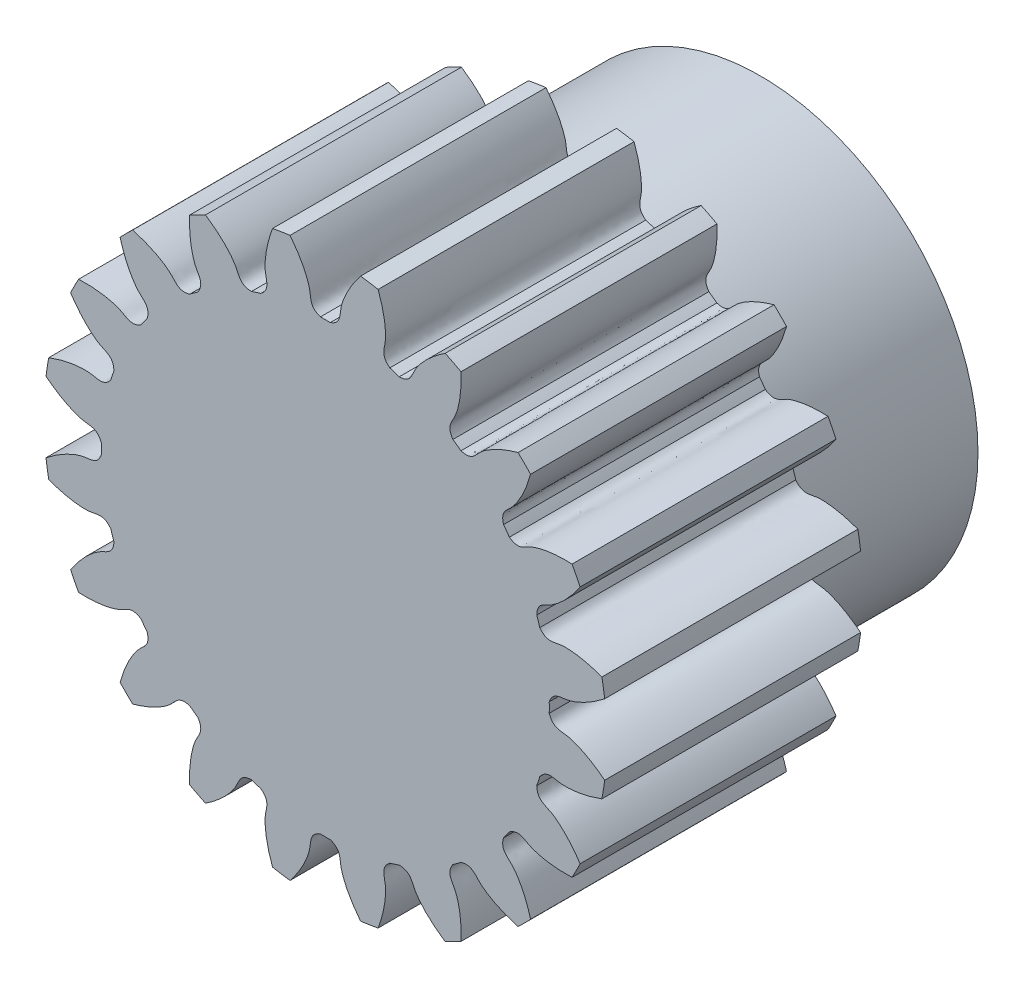
from build123d import *

# Parameters (mm, degrees)
SKETCH_1_R               = 22
EXTRUDE_1_DEPTH          = 20
CUT_EXTRUDE_1_DEPTH      = 37.986484018
PATTERN_CIRCULAR_1_COUNT = 20
SKETCH_4_R               = 17
EXTRUDE_2_DEPTH          = 14
SKETCH_5_R               = 3
CUT_EXTRUDE_2_DEPTH      = 14


with BuildPart() as part:
    # 草图1 → 凸台-拉伸1 (new body)
    with BuildSketch(Plane.XY):
        Circle(SKETCH_1_R)
    extrude(amount=EXTRUDE_1_DEPTH)

    # 草图2 → 切除-拉伸1 (cut, through all)
    with BuildSketch(Plane.XY):
        with BuildLine():
            ThreePointArc((0.386633201, 17.495728472), (0, 17.5), (-0.386633201, 17.495728472))
            add(Edge.make_bspline(
                [(-0.386633201, 17.495728472), (-1.22237881, 17.786951024), (-1.114168199, 18.374227398), (-1.225794113, 18.940018805), (-1.237784373, 18.995113228), (-1.25262178, 19.05726923), (-1.270584194, 19.126393672), (-1.29195828, 19.202382994), (-1.31702411, 19.285125656), (-1.346059743, 19.374501466), (-1.3793395, 19.470381894), (-1.4171342, 19.57263009), (-1.459710797, 19.681101001), (-1.507332204, 19.795641461), (-1.560257063, 19.916090303), (-1.618739529, 20.042278463), (-1.683029067, 20.174029102), (-1.753370234, 20.311157723), (-1.830002477, 20.4534723), (-1.913159931, 20.600773408), (-2.003071219, 20.752854362), (-2.099959252, 20.909501356), (-2.204041043, 21.070493611), (-2.315527511, 21.235603527), (-2.434623302, 21.404596841), (-2.561526601, 21.577232781), (-2.696428961, 21.753264241), (-2.839515123, 21.932437945), (-2.990962853, 22.114494623), (-3.15094277, 22.299169189), (-3.319618193, 22.486190926), (-3.497144978, 22.67528367), (-3.683671369, 22.866166005), (-3.879337852, 23.058551454), (-4.084277013, 23.252148679), (-4.298613397, 23.446661685), (-4.522463379, 23.641790022), (-4.755935037, 23.837228999), (-4.999128023, 24.032669892), (-5.252133469, 24.227800163), (-5.515033799, 24.42230368), (-5.882947182, 24.683279735), (-6.167864825, 24.872665202), (-6.362315964, 24.996503719)],
                knots=[0, 0, 0, 0, 0.165916003, 0.170905922, 0.176663519, 0.183188797, 0.190481754, 0.198542391, 0.207370708, 0.216966704, 0.22733038, 0.238461736, 0.250360771, 0.263027487, 0.276461881, 0.290663956, 0.30563371, 0.321371144, 0.337876258, 0.355149051, 0.373189524, 0.391997677, 0.411573509, 0.431917021, 0.453028213, 0.474907084, 0.497553636, 0.520967867, 0.545149777, 0.570099367, 0.595816637, 0.622301587, 0.649554216, 0.677574526, 0.706362514, 0.735918183, 0.766241531, 0.797332559, 0.829191267, 0.861817654, 0.895211721, 0.929373468, 1, 1, 1, 1], degree=3))
            ThreePointArc((-6.362315964, 24.996503719), (0, 25.793492641), (6.362315964, 24.996503719))
            add(Edge.make_bspline(
                [(0.386633201, 17.495728472), (1.22237881, 17.786951024), (1.114168199, 18.374227398), (1.225794113, 18.940018805), (1.237784373, 18.995113228), (1.25262178, 19.05726923), (1.270584194, 19.126393672), (1.29195828, 19.202382994), (1.31702411, 19.285125656), (1.346059743, 19.374501466), (1.3793395, 19.470381894), (1.4171342, 19.57263009), (1.459710797, 19.681101001), (1.507332204, 19.795641461), (1.560257063, 19.916090303), (1.618739529, 20.042278463), (1.683029067, 20.174029102), (1.753370234, 20.311157723), (1.830002477, 20.4534723), (1.913159931, 20.600773408), (2.003071219, 20.752854362), (2.099959252, 20.909501356), (2.204041043, 21.070493611), (2.315527511, 21.235603527), (2.434623302, 21.404596841), (2.561526601, 21.577232781), (2.696428961, 21.753264241), (2.839515123, 21.932437945), (2.990962853, 22.114494623), (3.15094277, 22.299169189), (3.319618193, 22.486190926), (3.497144978, 22.67528367), (3.683671369, 22.866166005), (3.879337852, 23.058551454), (4.084277013, 23.252148679), (4.298613397, 23.446661685), (4.522463379, 23.641790022), (4.755935037, 23.837228999), (4.999128023, 24.032669892), (5.252133469, 24.227800163), (5.515033799, 24.42230368), (5.882947182, 24.683279735), (6.167864825, 24.872665202), (6.362315964, 24.996503719)],
                knots=[0, 0, 0, 0, 0.165916003, 0.170905922, 0.176663519, 0.183188797, 0.190481754, 0.198542391, 0.207370708, 0.216966704, 0.22733038, 0.238461736, 0.250360771, 0.263027487, 0.276461881, 0.290663956, 0.30563371, 0.321371144, 0.337876258, 0.355149051, 0.373189524, 0.391997677, 0.411573509, 0.431917021, 0.453028213, 0.474907084, 0.497553636, 0.520967867, 0.545149777, 0.570099367, 0.595816637, 0.622301587, 0.649554216, 0.677574526, 0.706362514, 0.735918183, 0.766241531, 0.797332559, 0.829191267, 0.861817654, 0.895211721, 0.929373468, 1, 1, 1, 1], degree=3))
        make_face()
    cut_extrude_1 = extrude(amount=CUT_EXTRUDE_1_DEPTH, mode=Mode.SUBTRACT)

    # 阵列(圆周)1: 切除-拉伸1 ×20 about axis
    pattern_circular_1_axis = Axis((0, 0, -1.5), (0, 0, 1))
    for i in range(1, PATTERN_CIRCULAR_1_COUNT):
        add(cut_extrude_1.rotate(pattern_circular_1_axis, i * 360 / PATTERN_CIRCULAR_1_COUNT), mode=Mode.SUBTRACT)

    # 草图4 → 凸台-拉伸2 (add)
    with BuildSketch(Plane(origin=(0, 0, 0), x_dir=(-1, 0, 0), z_dir=(0, 0, -1))):
        Circle(SKETCH_4_R)
    extrude(amount=EXTRUDE_2_DEPTH)

    # 草图5 → 切除-拉伸2 (cut)
    with BuildSketch(Plane(origin=(0, 0, -14), x_dir=(-1, 0, 0), z_dir=(0, 0, -1))):
        Circle(SKETCH_5_R)
    extrude(amount=-CUT_EXTRUDE_2_DEPTH, mode=Mode.SUBTRACT)


solid = part.part
